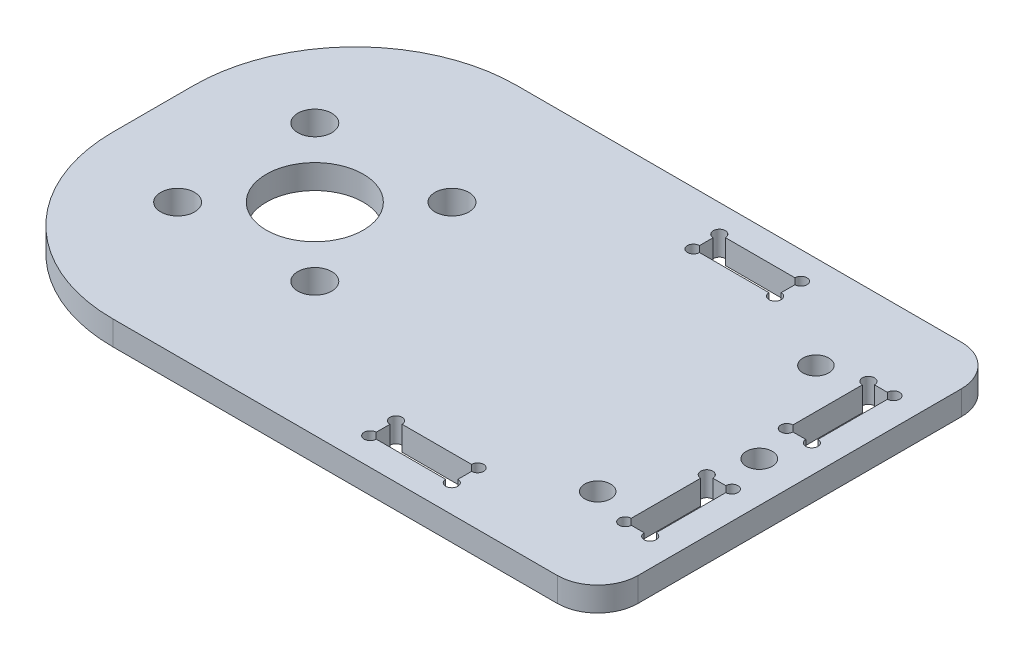
from build123d import *

# Parameters (mm, degrees)
SKETCH_1_W          = 80
SKETCH_1_H          = 50
EXTRUDE_1_DEPTH     = 3
SKETCH_2_R          = 6
SKETCH_2_R_2        = 2.1
CUT_EXTRUDE_1_DEPTH = 3
SKETCH_3_R          = 1.61
SKETCH_3_W          = 3.1
SKETCH_3_H          = 10.1
CUT_EXTRUDE_2_DEPTH = 3
SKETCH_4_R          = 1.6
SKETCH_4_W          = 10.1
SKETCH_4_H          = 3.2
CUT_EXTRUDE_3_DEPTH = 95.387499172
FILLET_1_R          = 20
FILLET_2_R          = 5
SKETCH_5_R          = 0.75
CUT_EXTRUDE_4_DEPTH = 95.387499172


with BuildPart() as part:
    # 草图1 → 凸台-拉伸1 (new body)
    with BuildSketch(Plane(origin=(0, 0, 0), x_dir=(1, 0, 0), z_dir=(0, 1, 0))):
        with Locations((40, -25)):
            Rectangle(SKETCH_1_W, SKETCH_1_H)
    extrude(amount=EXTRUDE_1_DEPTH)

    # 草图2 → 切除-拉伸1 (cut)
    with BuildSketch(Plane(origin=(0, 3, 0), x_dir=(1, 0, 0), z_dir=(0, 1, 0))):
        with Locations(Location((20, -25, 0), (0, 0, 270))):
            Circle(SKETCH_2_R)
        with Locations(Location((11.514718626, -16.514718626, 0), (0, 0, 270))):
            Circle(SKETCH_2_R_2)
        with Locations(Location((28.485281374, -16.514718626, 0), (0, 0, 270))):
            Circle(SKETCH_2_R_2)
        with Locations(Location((28.485281374, -33.485281374, 0), (0, 0, 270))):
            Circle(SKETCH_2_R_2)
        with Locations(Location((11.514718626, -33.485281374, 0), (0, 0, 270))):
            Circle(SKETCH_2_R_2)
    extrude(amount=-CUT_EXTRUDE_1_DEPTH, mode=Mode.SUBTRACT)

    # 草图3 → 切除-拉伸2 (cut)
    with BuildSketch(Plane(origin=(0, 3, 0), x_dir=(1, 0, 0), z_dir=(0, 1, 0))):
        with Locations(Location((75, -25, 0), (0, 0, 270))):
            Circle(SKETCH_3_R)
        with Locations((75, -15)):
            Rectangle(SKETCH_3_W, SKETCH_3_H)
        with Locations((75, -35)):
            Rectangle(SKETCH_3_W, SKETCH_3_H)
    extrude(amount=-CUT_EXTRUDE_2_DEPTH, mode=Mode.SUBTRACT)

    # 草图4 → 切除-拉伸3 (cut, through all)
    with BuildSketch(Plane(origin=(0, 3, 0), x_dir=(1, 0, 0), z_dir=(0, 1, 0))):
        with Locations(Location((68.5, -11.5, 0), (0, 0, 270))):
            Circle(SKETCH_4_R)
        with Locations(Location((68.5, -38.5, 0), (0, 0, 90))):
            Circle(SKETCH_4_R)
        with Locations((53.5, -5)):
            Rectangle(SKETCH_4_W, SKETCH_4_H)
        with Locations((53.5, -45)):
            Rectangle(SKETCH_4_W, SKETCH_4_H)
    extrude(amount=-CUT_EXTRUDE_3_DEPTH, mode=Mode.SUBTRACT)

    # 圆角1
    fillet_1_edges = [part.edges().sort_by_distance(p)[0] for p in [
        (0, 1.5, 0),
        (0, 1.5, 50),
    ]]
    fillet(fillet_1_edges, radius=FILLET_1_R)

    # 圆角2
    fillet_2_edges = [part.edges().sort_by_distance(p)[0] for p in [
        (80, 1.5, 0),
        (80, 1.5, 50),
    ]]
    fillet(fillet_2_edges, radius=FILLET_2_R)

    # 草图5 → 切除-拉伸4 (cut, through all)
    with BuildSketch(Plane(origin=(0, 3, 0), x_dir=(1, 0, 0), z_dir=(0, 1, 0))):
        with Locations((48.45, -3.4)):
            Circle(SKETCH_5_R)
        with Locations((48.45, -6.6)):
            Circle(SKETCH_5_R)
        with Locations((58.55, -6.6)):
            Circle(SKETCH_5_R)
        with Locations((58.55, -3.4)):
            Circle(SKETCH_5_R)
        with Locations((73.45, -9.95)):
            Circle(SKETCH_5_R)
        with Locations((76.55, -9.95)):
            Circle(SKETCH_5_R)
        with Locations((76.55, -20.05)):
            Circle(SKETCH_5_R)
        with Locations((73.45, -20.05)):
            Circle(SKETCH_5_R)
        with Locations((73.45, -29.95)):
            Circle(SKETCH_5_R)
        with Locations((76.55, -29.95)):
            Circle(SKETCH_5_R)
        with Locations((76.55, -40.05)):
            Circle(SKETCH_5_R)
        with Locations((73.45, -40.05)):
            Circle(SKETCH_5_R)
        with Locations((58.55, -46.6)):
            Circle(SKETCH_5_R)
        with Locations((58.55, -43.4)):
            Circle(SKETCH_5_R)
        with Locations((48.45, -43.4)):
            Circle(SKETCH_5_R)
        with Locations((48.45, -46.6)):
            Circle(SKETCH_5_R)
    extrude(amount=-CUT_EXTRUDE_4_DEPTH, mode=Mode.SUBTRACT)


solid = part.part
